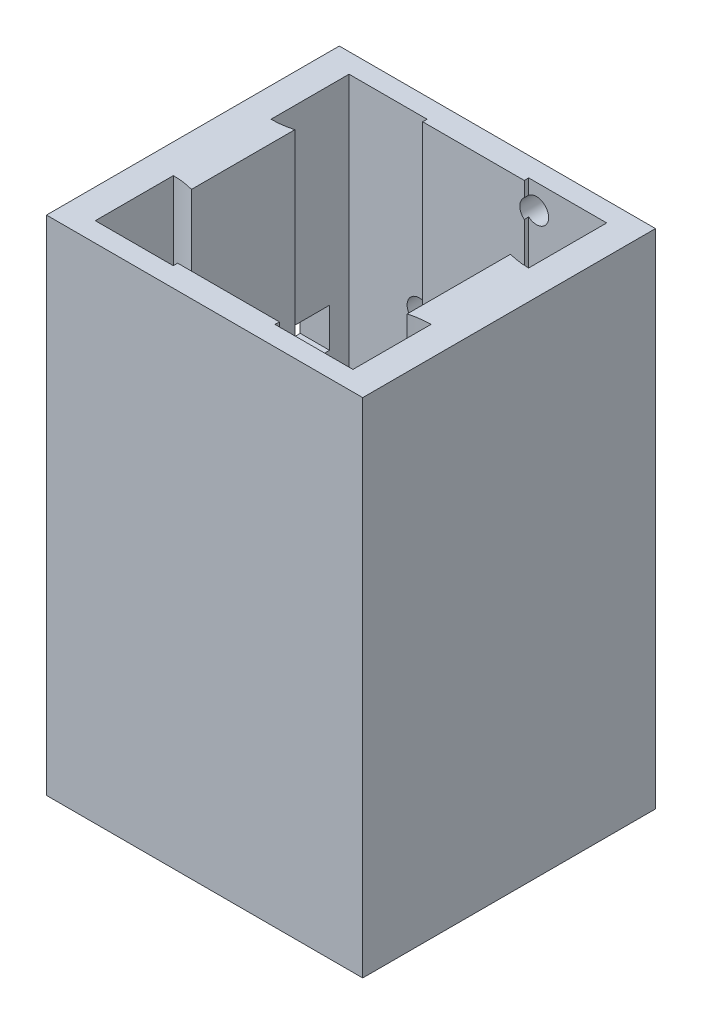
from build123d import *

# Parameters (mm, degrees)
SKETCH1_W           = 32.4
SKETCH1_H           = 30
SKETCH1_R           = 1.75
BOSS_EXTRUDE1_DEPTH = 25
SKETCH2_R           = 4
CUT_EXTRUDE1_DEPTH  = 20
BOSS_EXTRUDE2_START = 3
SKETCH3_W           = 32.4
SKETCH3_H           = 30
SKETCH3_R           = 4
BOSS_EXTRUDE2_DEPTH = 3
BOSS_EXTRUDE3_START = 23.5
SKETCH4_W           = 32.4
SKETCH4_H           = 30
BOSS_EXTRUDE3_DEPTH = 23.5
SKETCH5_R           = 1.25
CUT_EXTRUDE2_DEPTH  = 2.45
SKETCH6_W           = 22
SKETCH6_H           = 4
CUT_EXTRUDE3_DEPTH  = 5.15


with BuildPart() as part:
    # Sketch1 → Boss-Extrude1 (new body)
    with BuildSketch(Plane(origin=(0, 0, 0), x_dir=(1, 0, 0), z_dir=(0, 1, 0))):
        with Locations((16.2, -15)):
            Rectangle(SKETCH1_W, SKETCH1_H)
        with Locations(Location((6.2, -5, 0), (0, 0, 270))):
            Circle(SKETCH1_R, mode=Mode.SUBTRACT)
        with Locations(Location((26.2, -5, 0), (0, 0, 270))):
            Circle(SKETCH1_R, mode=Mode.SUBTRACT)
        with Locations(Location((26.2, -25, 0), (0, 0, 270))):
            Circle(SKETCH1_R, mode=Mode.SUBTRACT)
        with Locations(Location((6.2, -25, 0), (0, 0, 270))):
            Circle(SKETCH1_R, mode=Mode.SUBTRACT)
    extrude(amount=BOSS_EXTRUDE1_DEPTH)

    # Sketch2 → Cut-Extrude1 (cut)
    with BuildSketch(Plane(origin=(0, 25, 0), x_dir=(1, 0, 0), z_dir=(0, 1, 0))):
        with Locations(Location((16.2, -15, 0), (0, 0, 270))):
            Circle(SKETCH2_R)
    extrude(amount=-CUT_EXTRUDE1_DEPTH, mode=Mode.SUBTRACT)

    # Sketch3 → Boss-Extrude2 (add)
    with BuildSketch(Plane(origin=(0, 25, 0), x_dir=(1, 0, 0), z_dir=(0, 1, 0)).offset(BOSS_EXTRUDE2_START)):
        with Locations((16.2, -15)):
            Rectangle(SKETCH3_W, SKETCH3_H)
        with BuildLine():
            ThreePointArc((11, -2), (8.656854249, -7.656854249), (3, -10))
            Line((3, -10), (3, -2))
            Line((3, -2), (11, -2))
        make_face(mode=Mode.SUBTRACT)
        with BuildLine():
            ThreePointArc((29.4, -10), (23.743145751, -7.656854249), (21.4, -2))
            Line((21.4, -2), (29.4, -2))
            Line((29.4, -2), (29.4, -10))
        make_face(mode=Mode.SUBTRACT)
        with BuildLine():
            ThreePointArc((21.4, -28), (23.743145751, -22.343145751), (29.4, -20))
            Line((29.4, -20), (29.4, -28))
            Line((29.4, -28), (21.4, -28))
        make_face(mode=Mode.SUBTRACT)
        with BuildLine():
            ThreePointArc((3, -20), (8.656854249, -22.343145751), (11, -28))
            Line((11, -28), (3, -28))
            Line((3, -28), (3, -20))
        make_face(mode=Mode.SUBTRACT)
        with Locations(Location((16.2, -15, 0), (0, 0, 270))):
            Circle(SKETCH3_R, mode=Mode.SUBTRACT)
    extrude(amount=-BOSS_EXTRUDE2_DEPTH)

    # Sketch4 → Boss-Extrude3 (add)
    with BuildSketch(Plane(origin=(0, 28, 0), x_dir=(1, 0, 0), z_dir=(0, 1, 0)).offset(BOSS_EXTRUDE3_START)):
        with Locations((16.2, -15)):
            Rectangle(SKETCH4_W, SKETCH4_H)
        with BuildLine():
            Line((5.15, -20.294320277), (5.15, -9.705679723))
            ThreePointArc((5.15, -9.705679723), (4.085025855, -9.926078406), (3, -10))
            Line((3, -10), (3, -2))
            Line((3, -2), (11, -2))
            ThreePointArc((11, -2), (10.996832804, -2.225089113), (10.987333723, -2.45))
            Line((10.987333723, -2.45), (21.412666277, -2.45))
            ThreePointArc((21.412666277, -2.45), (21.403167196, -2.225089113), (21.4, -2))
            Line((21.4, -2), (29.4, -2))
            Line((29.4, -2), (29.4, -10))
            ThreePointArc((29.4, -10), (28.314974145, -9.926078406), (27.25, -9.705679723))
            Line((27.25, -9.705679723), (27.25, -20.294320277))
            ThreePointArc((27.25, -20.294320277), (28.314974145, -20.073921594), (29.4, -20))
            Line((29.4, -20), (29.4, -28))
            Line((29.4, -28), (21.4, -28))
            ThreePointArc((21.4, -28), (21.403167196, -27.774910887), (21.412666277, -27.55))
            Line((21.412666277, -27.55), (10.987333723, -27.55))
            ThreePointArc((10.987333723, -27.55), (10.996832804, -27.774910887), (11, -28))
            Line((11, -28), (3, -28))
            Line((3, -28), (3, -20))
            ThreePointArc((3, -20), (4.085025855, -20.073921594), (5.15, -20.294320277))
        make_face(mode=Mode.SUBTRACT)
    extrude(amount=-BOSS_EXTRUDE3_DEPTH)

    # Sketch5 → Cut-Extrude2 (cut)
    with BuildSketch(Plane(origin=(0, 0, 0), x_dir=(-1, 0, 0), z_dir=(0, 0, -1))):
        with Locations((-22.2, 49)):
            Circle(SKETCH5_R)
        with Locations((-10.2, 34)):
            Circle(SKETCH5_R)
    extrude(amount=-CUT_EXTRUDE2_DEPTH, mode=Mode.SUBTRACT)

    # Sketch6 → Cut-Extrude3 (cut)
    with BuildSketch(Plane.ZY):
        with Locations((15, 30)):
            Rectangle(SKETCH6_W, SKETCH6_H)
    extrude(amount=-CUT_EXTRUDE3_DEPTH, mode=Mode.SUBTRACT)


solid = part.part
